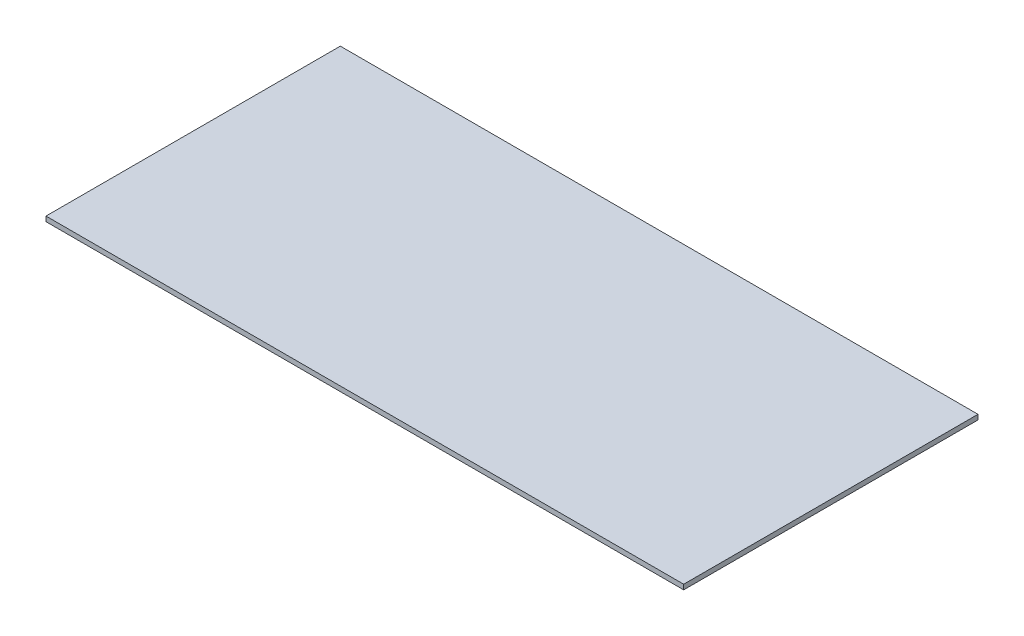
from build123d import *

# Parameters (mm, degrees)
SKETCH1_W           = 65
SKETCH1_H           = 30
BOSS_EXTRUDE1_DEPTH = 0.5


with BuildPart() as part:
    # Sketch1 → Boss-Extrude1 (new body)
    with BuildSketch(Plane(origin=(0, 0, 0), x_dir=(1, 0, 0), z_dir=(0, 1, 0))):
        with Locations((-32.5, -15)):
            Rectangle(SKETCH1_W, SKETCH1_H)
    extrude(amount=BOSS_EXTRUDE1_DEPTH)


solid = part.part
